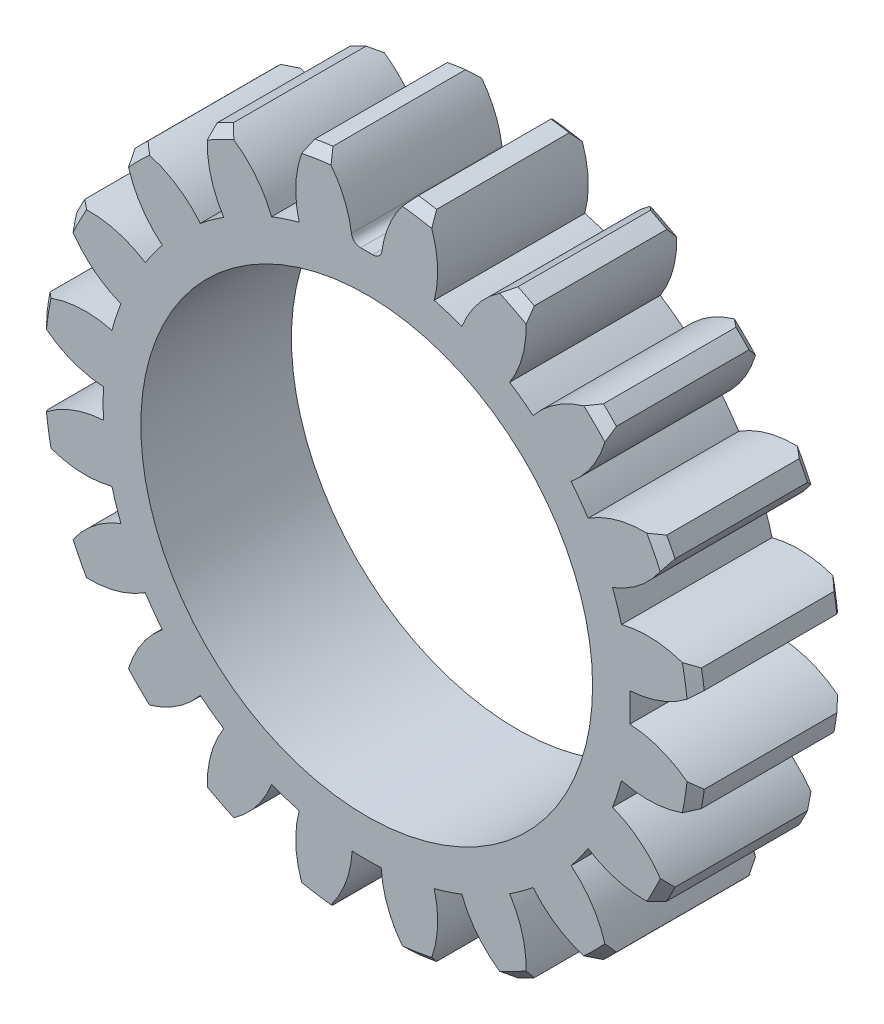
from build123d import *

# Parameters (mm, degrees)
SKETCH1_R           = 22
BOSS_EXTRUDE1_DEPTH = 10
CUT_EXTRUDE1_START  = -10
CUT_EXTRUDE1_DEPTH  = 10
FILLET1_R           = 0.6
CHAMFER1_SIZE       = 0.6
CIRPATTERN1_COUNT   = 20
SKETCH3_R           = 15
CUT_EXTRUDE2_DEPTH  = 10


with BuildPart() as part:
    # Sketch1 → Boss-Extrude1 (new body)
    with BuildSketch(Plane.XY):
        Circle(SKETCH1_R)
    extrude(amount=BOSS_EXTRUDE1_DEPTH)

    # Sketch2 → Cut-Extrude1 (cut)
    with BuildSketch(Plane.XY.offset(10).offset(CUT_EXTRUDE1_START)):
        with BuildLine():
            ThreePointArc((-0.962550115, 17.473508442), (-1.513028297, 19.811754334), (-2.83665719, 21.816355699))
            ThreePointArc((-2.83665719, 21.816355699), (0, 22), (2.83665719, 21.816355699))
            ThreePointArc((2.83665719, 21.816355699), (1.513028297, 19.811754334), (0.962550115, 17.473508442))
            ThreePointArc((0.962550115, 17.473508442), (0, 17.5), (-0.962550115, 17.473508442))
        make_face()
    cut_extrude1 = extrude(amount=CUT_EXTRUDE1_DEPTH, mode=Mode.SUBTRACT)

    # Fillet1
    fillet1_edges = [part.edges().sort_by_distance(p)[0] for p in [
        (0.962550115, 17.473508442, 5),
        (-0.962550115, 17.473508442, 5),
    ]]
    fillet(fillet1_edges, radius=FILLET1_R)

    # Chamfer1
    chamfer1_edges = [part.edges().sort_by_distance(p)[0] for p in [
        (0, -22, 0),
        (0, -22, 10),
    ]]
    chamfer(chamfer1_edges, length=CHAMFER1_SIZE)

    # CirPattern1: Cut-Extrude1 ×20 about axis
    cirpattern1_axis = Axis((0, 0, 0), (0, 0, 1))
    for i in range(1, CIRPATTERN1_COUNT):
        add(cut_extrude1.rotate(cirpattern1_axis, i * 360 / CIRPATTERN1_COUNT), mode=Mode.SUBTRACT)

    # Sketch3 → Cut-Extrude2 (cut)
    with BuildSketch(Plane.XY.offset(10)):
        Circle(SKETCH3_R)
    extrude(amount=-CUT_EXTRUDE2_DEPTH, mode=Mode.SUBTRACT)


solid = part.part
